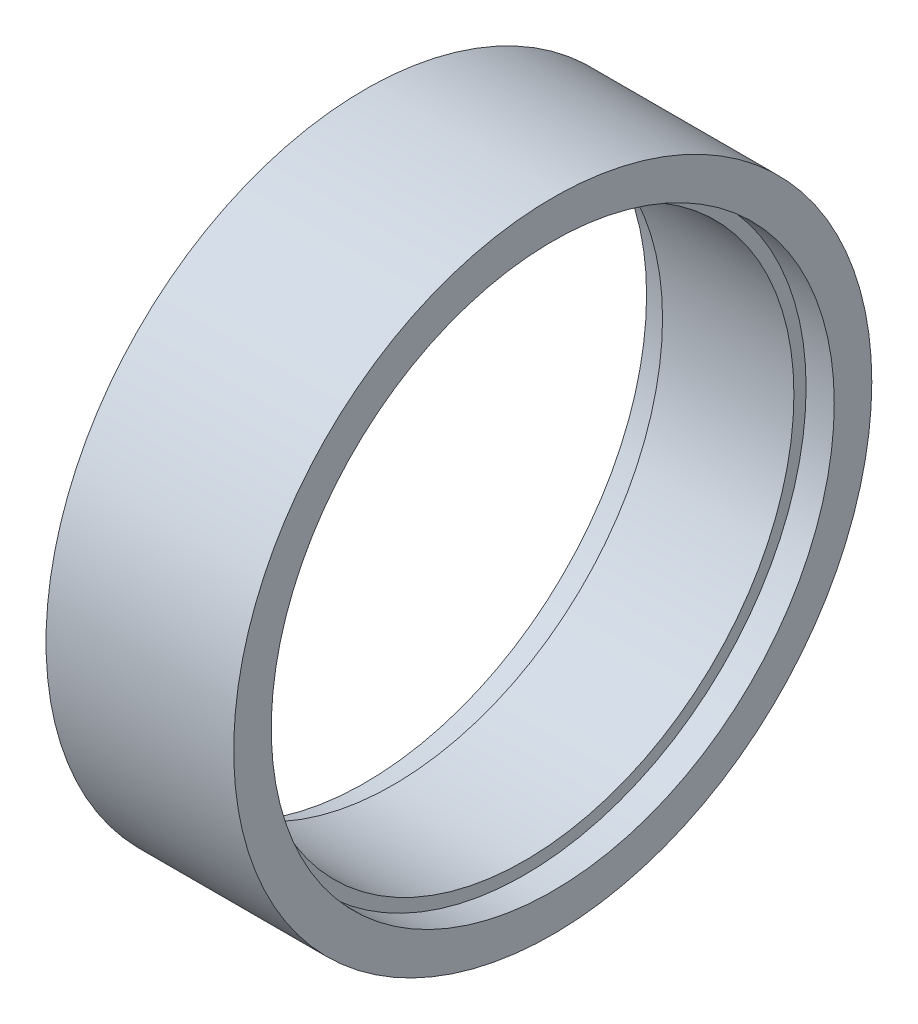
from build123d import *

# Parameters (mm, degrees)
SKETCH2_R                = 15
SKETCH2_R_2              = 14.35
BOSS_EXTRUDE1_DEPTH      = 7
BOSS_EXTRUDE2_DEPTH      = 1.5
BOSS_EXTRUDE2_DEPTH_BACK = 8.5
SKETCH3_R                = 17
SKETCH3_R_2              = 15


with BuildPart() as part:
    # Sketch2 → Boss-Extrude1 (new body)
    with BuildSketch(Plane(origin=(0, 0, 0), x_dir=(0, 0, -1), z_dir=(1, 0, 0))):
        Circle(SKETCH2_R)
        Circle(SKETCH2_R_2, mode=Mode.SUBTRACT)
    extrude(amount=BOSS_EXTRUDE1_DEPTH)


with BuildPart() as body_2:
    # Sketch3 → Boss-Extrude2 (new, two sides: drawn at the far end of the back side and taken through both)
    with BuildSketch(Plane(origin=(7, 0, 0), x_dir=(0, 0, -1), z_dir=(1, 0, 0)).offset(-BOSS_EXTRUDE2_DEPTH_BACK)):
        Circle(SKETCH3_R)
        Circle(SKETCH3_R_2, mode=Mode.SUBTRACT)
    extrude(amount=BOSS_EXTRUDE2_DEPTH + BOSS_EXTRUDE2_DEPTH_BACK)


solid = Compound([part.part, body_2.part])
